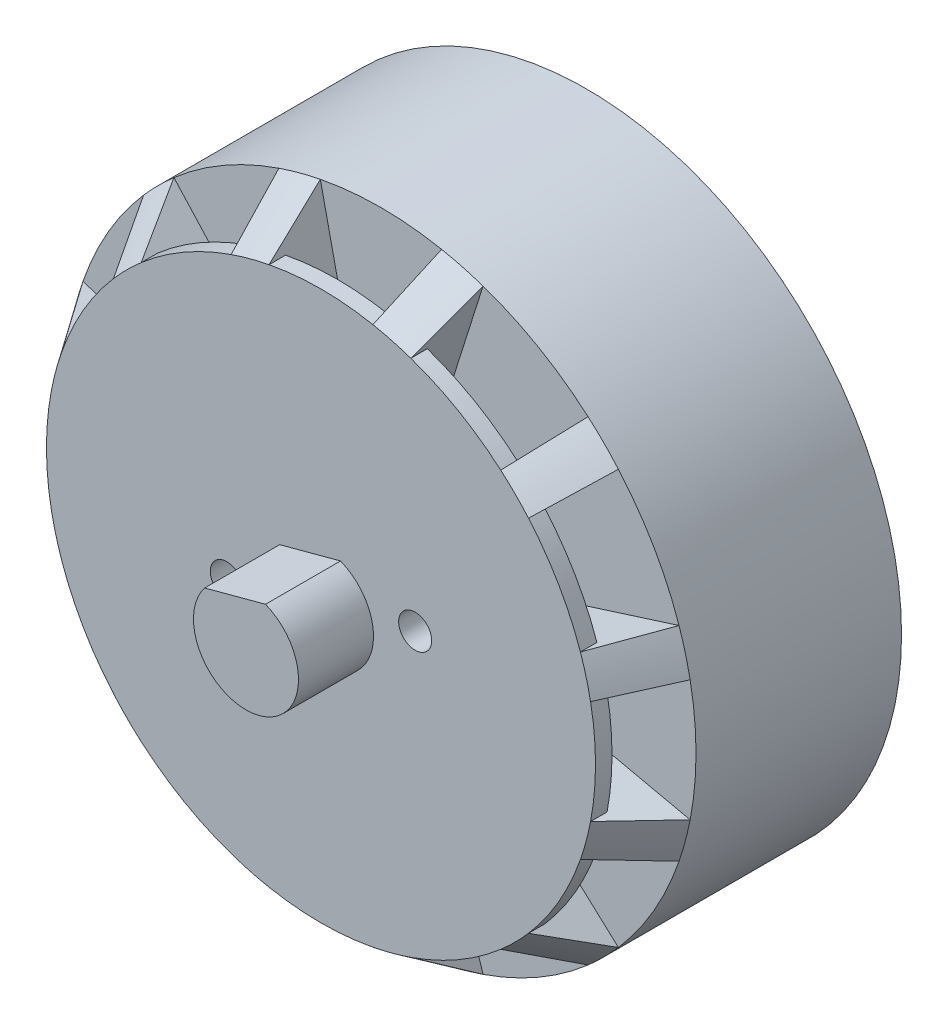
from build123d import *

# Parameters (mm, degrees)
SKETCH_1_R               = 21
EXTRUDE_1_DEPTH          = 13.7
SKETCH_3_R               = 21
SKETCH_2_R               = 18.3
CUT_EXTRUDE_START        = -4
CUT_EXTRUDE_1_DEPTH      = 4
PATTERN_CIRCULAR_1_COUNT = 12
SKETCH_5_R               = 18.3
EXTRUDE_2_DEPTH          = 1.1
EXTRUDE_3_DEPTH          = 5
SKETCH_8_R               = 3
EXTRUDE_4_DEPTH          = 4
SKETCH_9_R               = 1.1
CUT_EXTRUDE_3_DEPTH      = 4


with BuildPart() as part:
    # 草图1 → 凸台-拉伸1 (new body)
    with BuildSketch(Plane.XY):
        with Locations(Location((0, 0, 0), (0, 0, 180))):
            Circle(SKETCH_1_R)
    extrude(amount=EXTRUDE_1_DEPTH)

    # 草图3 → 放样1 section 0
    with BuildSketch(Plane.XY.offset(13.7)):
        Circle(SKETCH_3_R)
    # 草图2 → 放样1 section 1
    with BuildSketch(Plane.XY.offset(17.7)):
        Circle(SKETCH_2_R)
    loft()

    # 草图4 → 切除-拉伸1 (cut)
    with BuildSketch(Plane.XY.offset(17.7).offset(CUT_EXTRUDE_START)):
        with BuildLine():
            ThreePointArc((6.924234277, 1.027122038), (6.981032873, 0.51495634), (7, 0))
            Line((7, 0), (18.3, 0))
            ThreePointArc((18.3, 0), (18.217281615, 1.738001882), (17.969874258, 3.460291774))
            Line((17.969874258, 3.460291774), (6.924234277, 1.027122038))
        make_face()
        with BuildLine():
            Line((18.3, 0), (7, 0))
            ThreePointArc((7, 0), (6.981032873, -0.51495634), (6.924234277, -1.027122038))
            Line((6.924234277, -1.027122038), (17.969874258, -3.460291774))
            ThreePointArc((17.969874258, -3.460291774), (18.217281615, -1.738001882), (18.3, 0))
        make_face()
        with BuildLine():
            ThreePointArc((17.969874258, 3.460291774), (18.217281615, 1.738001882), (18.3, 0))
            Line((18.3, 0), (21, 0))
            ThreePointArc((21, 0), (20.9016371, 2.030164166), (20.607469853, 4.041309967))
            Line((20.607469853, 4.041309967), (17.969874258, 3.460291774))
        make_face()
        with BuildLine():
            Line((21, 0), (18.3, 0))
            ThreePointArc((18.3, 0), (18.217281615, -1.738001882), (17.969874258, -3.460291774))
            Line((17.969874258, -3.460291774), (20.607469853, -4.041309967))
            ThreePointArc((20.607469853, -4.041309967), (20.9016371, -2.030164166), (21, 0))
        make_face()
    cut_extrude_1 = extrude(amount=CUT_EXTRUDE_1_DEPTH, mode=Mode.SUBTRACT)

    # 阵列(圆周)1: 切除-拉伸1 ×12 about axis
    pattern_circular_1_axis = Axis((0, 0, 0), (0, 0, 1))
    for i in range(1, PATTERN_CIRCULAR_1_COUNT):
        add(cut_extrude_1.rotate(pattern_circular_1_axis, i * 360 / PATTERN_CIRCULAR_1_COUNT), mode=Mode.SUBTRACT)

    # 草图5 → 凸台-拉伸2 (add)
    with BuildSketch(Plane.XY.offset(17.7)):
        Circle(SKETCH_5_R)
    extrude(amount=-EXTRUDE_2_DEPTH)

    # 草图6 → 凸台-拉伸3 (add)
    with BuildSketch(Plane.XY.offset(17.7)):
        with BuildLine():
            Line((-2.753137561, 2.161072319), (1.303750909, 3.248112308))
            ThreePointArc((1.303750909, 3.248112308), (0.905866658, -3.380740392), (-2.753137561, 2.161072319))
        make_face()
    extrude(amount=EXTRUDE_3_DEPTH)

    # 草图8 → 凸台-拉伸4 (add)
    with BuildSketch(Plane.XY.offset(17.7)):
        with Locations((6.278517871, 1.682323793)):
            Circle(SKETCH_8_R)
        with Locations((-6.278517871, -1.682323793)):
            Circle(SKETCH_8_R)
    extrude(amount=-EXTRUDE_4_DEPTH)

    # 草图9 → 切除-拉伸3 (cut)
    with BuildSketch(Plane.XY.offset(17.7)):
        with Locations((6.278517871, 1.682323793)):
            Circle(SKETCH_9_R)
        with Locations((-6.278517871, -1.682323793)):
            Circle(SKETCH_9_R)
    extrude(amount=-CUT_EXTRUDE_3_DEPTH, mode=Mode.SUBTRACT)


solid = part.part
